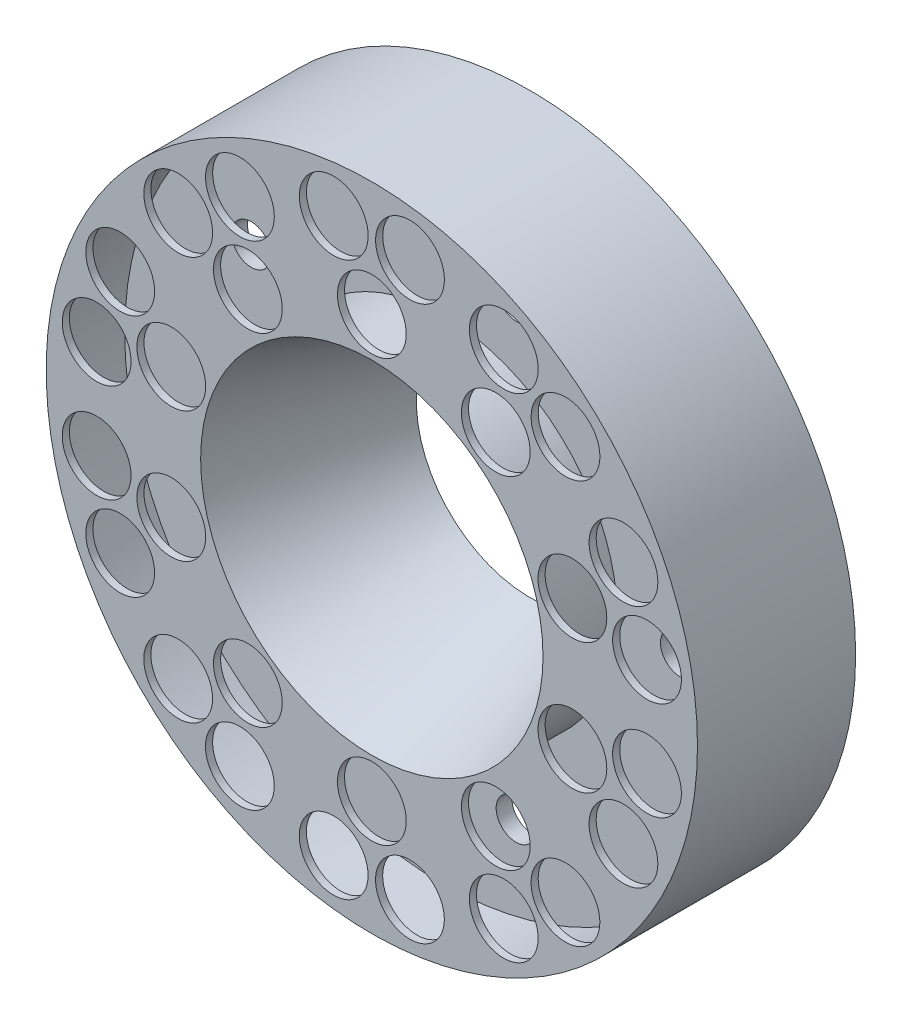
from build123d import *

# Parameters (mm, degrees)
SKETCH1_R               = 104.60742403
BOSS_EXTRUDE6_DEPTH     = 50.8
SKETCH4_R               = 54.991
CUT_EXTRUDE2_DEPTH      = 109.982
CUT_EXTRUDE2_DRAFT      = -20
SKETCH6_R               = 11.049
CUT_EXTRUDE4_DEPTH      = 22.86
CUT_EXTRUDE5_DEPTH      = 8.89
CUT_EXTRUDE5_DEPTH_BACK = 13.97
SKETCH8_R               = 102.235
SKETCH8_R_2             = 56.007
CUT_EXTRUDE6_DEPTH      = 8.89
CUT_EXTRUDE6_DEPTH_BACK = 11.684
SKETCH9_R               = 102.235
SKETCH9_R_2             = 56.007
CUT_EXTRUDE7_DEPTH      = 2.54
CUT_EXTRUDE7_DEPTH_BACK = 2.54
SKETCH10_R              = 6.35


with BuildPart() as part:
    # Sketch1 → Boss-Extrude6 (new body)
    with BuildSketch(Plane.XY):
        with Locations((-38.924588073, 36.746668339)):
            Circle(SKETCH1_R)
    extrude(amount=BOSS_EXTRUDE6_DEPTH)


with BuildPart() as cut_extrude2_tool:
    # Sketch4 → Cut-Extrude2 (with draft: the straight prism first)
    with BuildSketch(Plane.XY.offset(50.8)):
        with Locations((-38.924588073, 36.746668339)):
            Circle(SKETCH4_R)
    extrude(amount=-CUT_EXTRUDE2_DEPTH)
    # Cut-Extrude2: the draft: its side faces are tilted about the plane it starts from
    cut_extrude2_sides = [cut_extrude2_tool.faces().sort_by_distance(p)[0] for p in [
        (-93.915588073, 36.746668339, -4.191),
    ]]
    draft(cut_extrude2_sides, Plane.XY.offset(50.8), CUT_EXTRUDE2_DRAFT)


with BuildPart() as part_1:
    add(part.part)

    # Cut-Extrude2: cut by cut_extrude2_tool
    add(cut_extrude2_tool.part, mode=Mode.SUBTRACT)

    # Sketch6 → Cut-Extrude4 (cut)
    with BuildSketch(Plane.XY.offset(50.8)):
        with Locations((23.28775176, 101.513937691)):
            Circle(SKETCH6_R)
        with Locations((-26.662993645, 125.711985788)):
            Circle(SKETCH6_R)
        with Locations((-38.924588073, 104.485307018)):
            Circle(SKETCH6_R)
        with Locations((-51.165531001, 125.711985788)):
            Circle(SKETCH6_R)
        with Locations((0.891184754, 91.548378206)):
            Circle(SKETCH6_R)
        with Locations((3.464782634, 115.916167792)):
            Circle(SKETCH6_R)
        with Locations((49.475497868, 52.57699406)):
            Circle(SKETCH6_R)
        with Locations((25.498685648, 57.679058867)):
            Circle(SKETCH6_R)
        with Locations((41.90379742, 75.880291878)):
            Circle(SKETCH6_R)
        with Locations((41.897415755, -2.406595944)):
            Circle(SKETCH6_R)
        with Locations((25.498685648, 15.814277811)):
            Circle(SKETCH6_R)
        with Locations((49.469116204, 20.896701874)):
            Circle(SKETCH6_R)
        with Locations((3.448075219, -42.434969762)):
            Circle(SKETCH6_R)
        with Locations((0.891184754, -18.055041529)):
            Circle(SKETCH6_R)
        with Locations((23.271044345, -28.03273966)):
            Circle(SKETCH6_R)
        with Locations((-51.186182501, -52.218649111)):
            Circle(SKETCH6_R)
        with Locations((-38.924588073, -30.991970341)):
            Circle(SKETCH6_R)
        with Locations((-26.683645145, -52.218649111)):
            Circle(SKETCH6_R)
        with Locations((-101.136927905, -28.020601013)):
            Circle(SKETCH6_R)
        with Locations((-78.740360899, -18.055041529)):
            Circle(SKETCH6_R)
        with Locations((-81.313958779, -42.422831115)):
            Circle(SKETCH6_R)
        with Locations((-127.324674013, 20.916342618)):
            Circle(SKETCH6_R)
        with Locations((-103.347861794, 15.814277811)):
            Circle(SKETCH6_R)
        with Locations((-119.752973565, -2.3869552)):
            Circle(SKETCH6_R)
        with Locations((-119.746591901, 75.899932621)):
            Circle(SKETCH6_R)
        with Locations((-103.347861794, 57.679058867)):
            Circle(SKETCH6_R)
        with Locations((-127.318292349, 52.596634803)):
            Circle(SKETCH6_R)
        with Locations((-81.297251365, 115.928306439)):
            Circle(SKETCH6_R)
        with Locations((-78.740360899, 91.548378206)):
            Circle(SKETCH6_R)
        with Locations((-101.120220491, 101.526076338)):
            Circle(SKETCH6_R)
    extrude(amount=-CUT_EXTRUDE4_DEPTH, mode=Mode.SUBTRACT)

    # Sketch8 → Cut-Extrude5 (cut, two sides: drawn at the far end of the back side and taken through both)
    with BuildSketch(Plane.XY.offset(13.97).offset(-CUT_EXTRUDE5_DEPTH_BACK)):
        with Locations((-38.924588073, 36.746668339)):
            Circle(SKETCH8_R)
        with Locations((-38.924588073, 36.746668339)):
            Circle(SKETCH8_R_2, mode=Mode.SUBTRACT)
    extrude(amount=CUT_EXTRUDE5_DEPTH + CUT_EXTRUDE5_DEPTH_BACK, mode=Mode.SUBTRACT)

    # Sketch9 → Cut-Extrude6 (cut, two sides: drawn at the far end of the back side and taken through both)
    with BuildSketch(Plane(origin=(0, 0, 36.83), x_dir=(-1, 0, 0), z_dir=(0, 0, -1)).offset(-CUT_EXTRUDE6_DEPTH_BACK)):
        with Locations(Location((38.924588073, 36.746668339, 0), (0, 0, 180))):
            Circle(SKETCH9_R)
        with Locations(Location((38.924588073, 36.746668339, 0), (0, 0, 180))):
            Circle(SKETCH9_R_2, mode=Mode.SUBTRACT)
    extrude(amount=CUT_EXTRUDE6_DEPTH + CUT_EXTRUDE6_DEPTH_BACK, mode=Mode.SUBTRACT)

    # Sketch10 → Cut-Extrude7 (cut, two sides: drawn at the far end of the back side and taken through both)
    with BuildSketch(Plane.XY.offset(25.4).offset(-CUT_EXTRUDE7_DEPTH_BACK)):
        with Locations((37.275304422, 36.618668929)):
            Circle(SKETCH10_R)
        with Locations((-15.499260995, -35.763289952)):
            Circle(SKETCH10_R)
        with Locations((-100.646832236, -7.938950998)):
            Circle(SKETCH10_R)
        with Locations((-15.25579165, 109.177518644)):
            Circle(SKETCH10_R)
        with Locations((-100.496359905, 81.639395071)):
            Circle(SKETCH10_R)
    extrude(amount=CUT_EXTRUDE7_DEPTH + CUT_EXTRUDE7_DEPTH_BACK, mode=Mode.SUBTRACT)


solid = part_1.part
